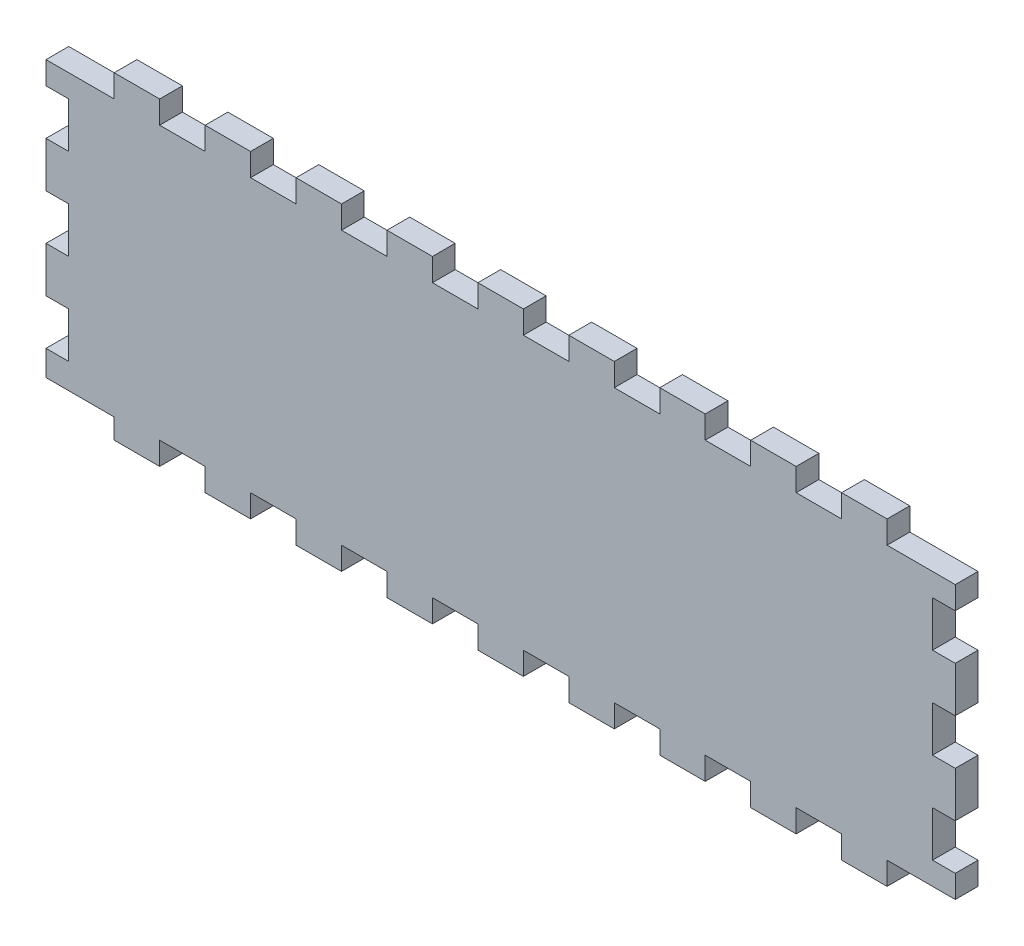
from build123d import *

# Parameters (mm, degrees)
SKETCH2_W           = 88.9
SKETCH2_H           = 6.35
BOSS_EXTRUDE1_DEPTH = 254
SKETCH3_W           = 6.35
SKETCH3_H           = 12.7
SKETCH3_W_2         = 12.7
SKETCH3_H_2         = 6.35
SKETCH3_W_3         = 19.05
SKETCH3_H_3         = 5.615455356
CUT_EXTRUDE1_DEPTH  = 254


with BuildPart() as part:
    # Sketch2 → Boss-Extrude1 (new body)
    with BuildSketch(Plane.YZ):
        with Locations((44.45, 3.175)):
            Rectangle(SKETCH2_W, SKETCH2_H)
    extrude(amount=BOSS_EXTRUDE1_DEPTH)

    # Sketch3 → Cut-Extrude1 (cut)
    with BuildSketch(Plane.XY.offset(6.35)):
        with Locations((3.175, 19.05)):
            Rectangle(SKETCH3_W, SKETCH3_H)
        with Locations((250.825, 19.05)):
            Rectangle(SKETCH3_W, SKETCH3_H)
        with Locations((3.175, 44.45)):
            Rectangle(SKETCH3_W, SKETCH3_H)
        with Locations((3.175, 69.85)):
            Rectangle(SKETCH3_W, SKETCH3_H)
        with Locations((250.825, 44.45)):
            Rectangle(SKETCH3_W, SKETCH3_H)
        with Locations((250.825, 69.85)):
            Rectangle(SKETCH3_W, SKETCH3_H)
        with Locations((88.9, 3.175)):
            Rectangle(SKETCH3_W_2, SKETCH3_H_2)
        with Locations((63.5, 3.175)):
            Rectangle(SKETCH3_W_2, SKETCH3_H_2)
        with Locations((114.3, 3.175)):
            Rectangle(SKETCH3_W_2, SKETCH3_H_2)
        with Locations((139.7, 3.175)):
            Rectangle(SKETCH3_W_2, SKETCH3_H_2)
        with Locations((165.1, 3.175)):
            Rectangle(SKETCH3_W_2, SKETCH3_H_2)
        with Locations((190.5, 3.175)):
            Rectangle(SKETCH3_W_2, SKETCH3_H_2)
        with Locations((215.9, 3.175)):
            Rectangle(SKETCH3_W_2, SKETCH3_H_2)
        with Locations((244.475, 3.175)):
            Rectangle(SKETCH3_W_3, SKETCH3_H_2)
        with Locations((88.9, 85.725)):
            Rectangle(SKETCH3_W_2, SKETCH3_H_2)
        with Locations((63.5, 85.725)):
            Rectangle(SKETCH3_W_2, SKETCH3_H_2)
        with Locations((114.3, 85.725)):
            Rectangle(SKETCH3_W_2, SKETCH3_H_2)
        with Locations((139.7, 85.725)):
            Rectangle(SKETCH3_W_2, SKETCH3_H_2)
        with Locations((165.1, 85.725)):
            Rectangle(SKETCH3_W_2, SKETCH3_H_2)
        with Locations((190.5, 85.725)):
            Rectangle(SKETCH3_W_2, SKETCH3_H_2)
        with Locations((215.9, 85.725)):
            Rectangle(SKETCH3_W_2, SKETCH3_H_2)
        with Locations((244.475, 85.725)):
            Rectangle(SKETCH3_W_3, SKETCH3_H_2)
        with Locations((38.1, 85.725)):
            Rectangle(SKETCH3_W_2, SKETCH3_H_2)
        with Locations((9.525, 85.725)):
            Rectangle(SKETCH3_W_3, SKETCH3_H_2)
        with Locations((9.525, 2.807727678)):
            Rectangle(SKETCH3_W_3, SKETCH3_H_3)
        with Locations((38.1, 3.175)):
            Rectangle(SKETCH3_W_2, SKETCH3_H_2)
    extrude(amount=-CUT_EXTRUDE1_DEPTH, mode=Mode.SUBTRACT)


solid = part.part
